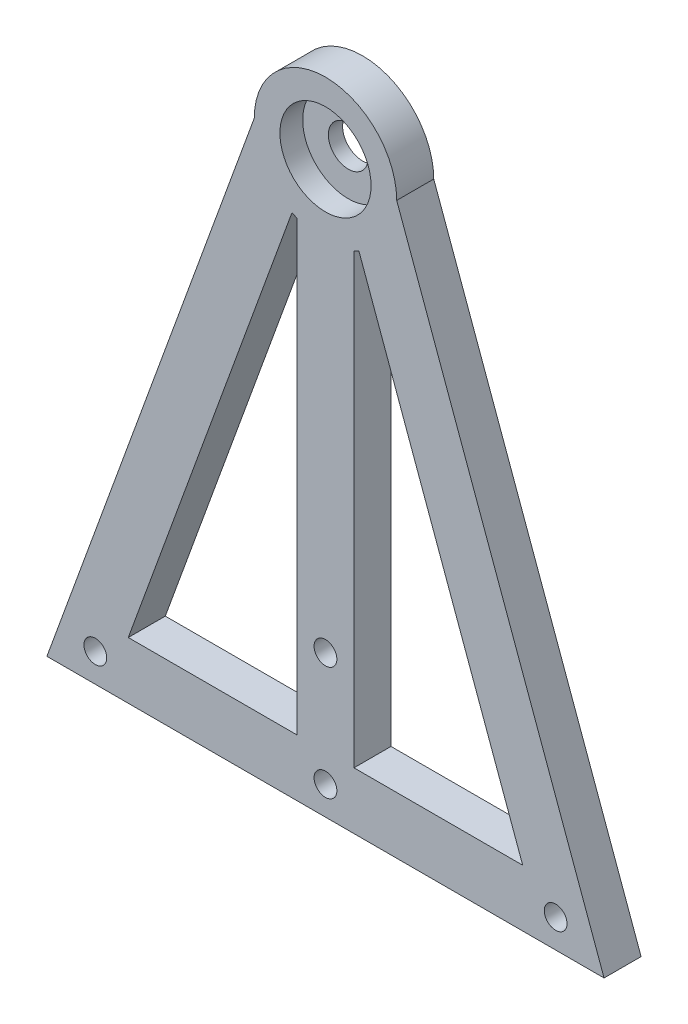
from build123d import *

# Parameters (mm, degrees)
SKETCH1_R           = 12.5
BOSS_EXTRUDE1_DEPTH = 6.5
CUT_EXTRUDE1_REACH  = 124.839
SKETCH2_R           = 3.5
SKETCH2_3_R         = 8
SKETCH2_3_R_2       = 3.5
CUT_EXTRUDE2_DEPTH  = 4
CUT_EXTRUDE4_REACH  = 124.839
SKETCH3_R           = 2


with BuildPart() as part:
    # Sketch1 → Boss-Extrude1 (new body)
    with BuildSketch(Plane.XY):
        with Locations((0, 100)):
            Circle(SKETCH1_R)
        with BuildLine():
            Line((-48.897023427, 0), (48.897023427, 0))
            Line((48.897023427, 0), (12.5, 100))
            ThreePointArc((12.5, 100), (10.716279715, 93.564834962), (5.87418415, 88.966235431))
            Line((5.87418415, 88.966235431), (34.615543359, 10))
            Line((34.615543359, 10), (-34.615543359, 10))
            Line((-34.615543359, 10), (-5.87418415, 88.966235431))
            ThreePointArc((-5.87418415, 88.966235431), (-10.716279715, 93.564834962), (-12.5, 100))
            Line((-12.5, 100), (-48.897023427, 0))
        make_face()
        with BuildLine():
            Line((-5, 10), (5, 10))
            Line((5, 10), (5, 88.543560763))
            ThreePointArc((5, 88.543560763), (0, 87.5), (-5, 88.543560763))
            Line((-5, 88.543560763), (-5, 10))
        make_face()
    extrude(amount=BOSS_EXTRUDE1_DEPTH)

    # Sketch2 → Cut-Extrude1 (cut, up to next)
    with BuildSketch(Plane.XY.offset(6.5), mode=Mode.PRIVATE) as cut_extrude1_sk1:
        with Locations((0, 100)):
            Circle(SKETCH2_R)
    cut_extrude1_tool1 = extrude(cut_extrude1_sk1.sketch, amount=-CUT_EXTRUDE1_REACH, mode=Mode.PRIVATE) & part.part
    add(cut_extrude1_tool1.solids().sort_by_distance((0, 100, 6.5))[0], mode=Mode.SUBTRACT)

    # Sketch2<3> → Cut-Extrude2 (cut)
    with BuildSketch(Plane.XY.offset(6.5)):
        with Locations((0, 100)):
            Circle(SKETCH2_3_R)
        with Locations((0, 100)):
            Circle(SKETCH2_3_R_2, mode=Mode.SUBTRACT)
    extrude(amount=-CUT_EXTRUDE2_DEPTH, mode=Mode.SUBTRACT)

    # Sketch3 → Cut-Extrude4 (cut, up to next)
    with BuildSketch(Plane.XY.offset(6.5), mode=Mode.PRIVATE) as cut_extrude4_sk1:
        with Locations((0, 5)):
            Circle(SKETCH3_R)
    cut_extrude4_tool1 = extrude(cut_extrude4_sk1.sketch, amount=-CUT_EXTRUDE4_REACH, mode=Mode.PRIVATE) & part.part
    # Sketch3 → Cut-Extrude4 (cut, up to next)
    with BuildSketch(Plane.XY.offset(6.5), mode=Mode.PRIVATE) as cut_extrude4_sk2:
        with Locations((40.397023427, 5)):
            Circle(SKETCH3_R)
    cut_extrude4_tool2 = extrude(cut_extrude4_sk2.sketch, amount=-CUT_EXTRUDE4_REACH, mode=Mode.PRIVATE) & part.part
    # Sketch3 → Cut-Extrude4 (cut, up to next)
    with BuildSketch(Plane.XY.offset(6.5), mode=Mode.PRIVATE) as cut_extrude4_sk3:
        with Locations((-40.397023427, 5)):
            Circle(SKETCH3_R)
    cut_extrude4_tool3 = extrude(cut_extrude4_sk3.sketch, amount=-CUT_EXTRUDE4_REACH, mode=Mode.PRIVATE) & part.part
    # Sketch3 → Cut-Extrude4 (cut, up to next)
    with BuildSketch(Plane.XY.offset(6.5), mode=Mode.PRIVATE) as cut_extrude4_sk4:
        with Locations((0, 25)):
            Circle(SKETCH3_R)
    cut_extrude4_tool4 = extrude(cut_extrude4_sk4.sketch, amount=-CUT_EXTRUDE4_REACH, mode=Mode.PRIVATE) & part.part
    add(cut_extrude4_tool1.solids().sort_by_distance((0, 5, 6.5))[0], mode=Mode.SUBTRACT)
    add(cut_extrude4_tool2.solids().sort_by_distance((40.397023, 5, 6.5))[0], mode=Mode.SUBTRACT)
    add(cut_extrude4_tool3.solids().sort_by_distance((-40.397023, 5, 6.5))[0], mode=Mode.SUBTRACT)
    add(cut_extrude4_tool4.solids().sort_by_distance((0, 25, 6.5))[0], mode=Mode.SUBTRACT)


solid = part.part
